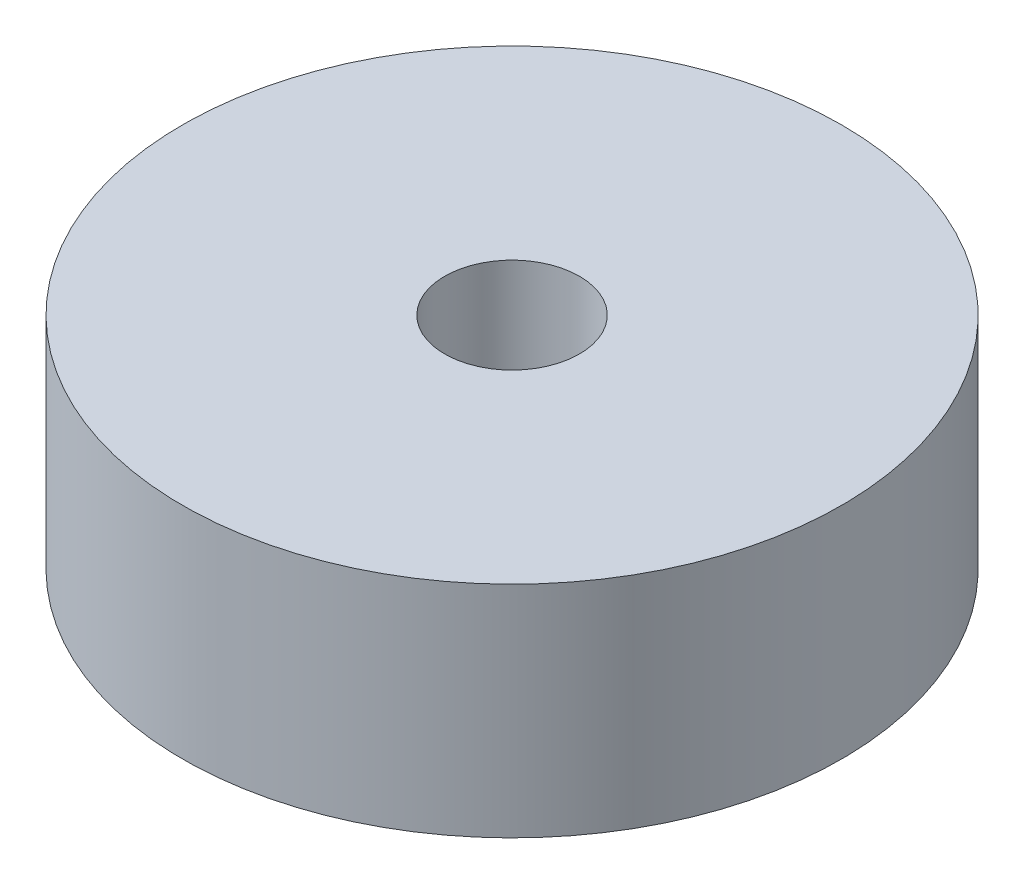
from build123d import *

# Parameters (mm, degrees)
SKETCH2_R           = 28.575
SKETCH2_R_2         = 5.842
BOSS_EXTRUDE1_DEPTH = 19.05


with BuildPart() as part:
    # Sketch2 → Boss-Extrude1 (new body)
    with BuildSketch(Plane(origin=(0, 0, 0), x_dir=(1, 0, 0), z_dir=(0, 1, 0))):
        with Locations(Location((0, 0, 0), (0, 0, 90))):
            Circle(SKETCH2_R)
        with Locations(Location((0, 0, 0), (0, 0, 90))):
            Circle(SKETCH2_R_2, mode=Mode.SUBTRACT)
    extrude(amount=BOSS_EXTRUDE1_DEPTH)


solid = part.part
